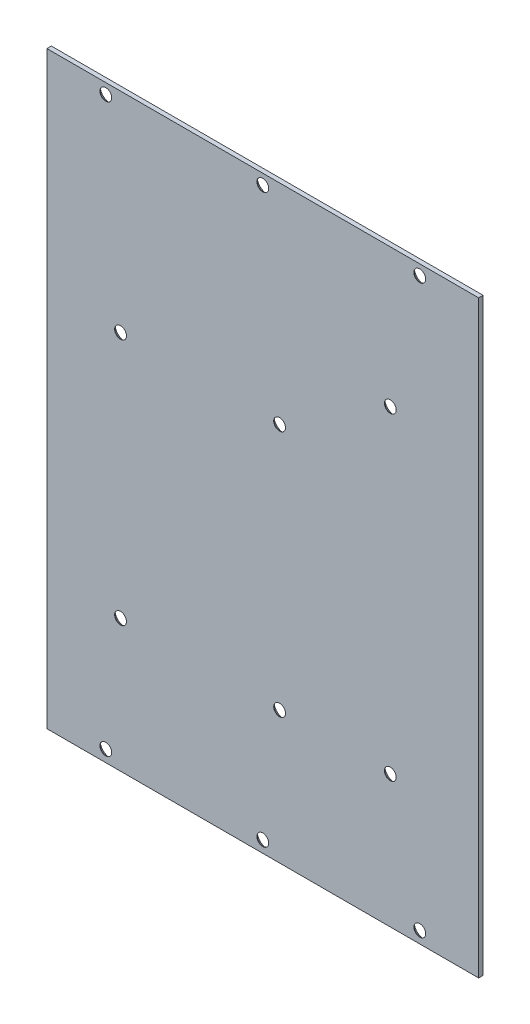
from build123d import *

# Parameters (mm, degrees)
SKETCH_1_W          = 146.6
SKETCH_1_H          = 200
EXTRUDE_1_DEPTH     = 1.5
SKETCH_2_R          = 2
CUT_EXTRUDE_1_DEPTH = 248.979454794
SKETCH_3_R          = 2
CUT_EXTRUDE_2_DEPTH = 248.979454794
SKETCH_4_R          = 2
CUT_EXTRUDE_3_DEPTH = 248.979454794
CHAMFER_1_SIZE      = 1.4


with BuildPart() as part:
    # Эскиз1 → Бобышка-Вытянуть1 (new body)
    with BuildSketch(Plane.XY):
        with Locations((73.3, 100)):
            Rectangle(SKETCH_1_W, SKETCH_1_H)
    extrude(amount=EXTRUDE_1_DEPTH)

    # Эскиз2 → Вырез-Вытянуть1 (cut, through all)
    with BuildSketch(Plane.XY.offset(1.5)):
        with Locations((20, 4)):
            Circle(SKETCH_2_R)
        with Locations((20, 196.5)):
            Circle(SKETCH_2_R)
        with Locations((73.3, 196.5)):
            Circle(SKETCH_2_R)
        with Locations((73.3, 4)):
            Circle(SKETCH_2_R)
        with Locations((126.6, 196.5)):
            Circle(SKETCH_2_R)
        with Locations((126.6, 4)):
            Circle(SKETCH_2_R)
    extrude(amount=-CUT_EXTRUDE_1_DEPTH, mode=Mode.SUBTRACT)

    # Эскиз3 → Вырез-Вытянуть2 (cut, through all)
    with BuildSketch(Plane.XY.offset(1.5)):
        with Locations((25, 45)):
            Circle(SKETCH_3_R)
        with Locations((79, 45)):
            Circle(SKETCH_3_R)
        with Locations((79, 129)):
            Circle(SKETCH_3_R)
        with Locations((25, 129)):
            Circle(SKETCH_3_R)
    extrude(amount=-CUT_EXTRUDE_2_DEPTH, mode=Mode.SUBTRACT)

    # Эскиз4 → Вырез-Вытянуть3 (cut, through all)
    with BuildSketch(Plane.XY.offset(1.5)):
        with Locations((116.6, 45)):
            Circle(SKETCH_4_R)
        with Locations((116.6, 153)):
            Circle(SKETCH_4_R)
    extrude(amount=-CUT_EXTRUDE_3_DEPTH, mode=Mode.SUBTRACT)

    # Фаска1
    chamfer_1_edges = [part.edges().sort_by_distance(p)[0] for p in [
        (124.6, 4, 0),
        (71.3, 196.5, 0),
        (71.3, 4, 0),
        (18, 196.5, 0),
        (124.6, 196.5, 0),
        (18, 4, 0),
        (23, 129, 0),
        (77, 129, 0),
        (77, 45, 0),
        (23, 45, 0),
        (114.6, 45, 0),
        (114.6, 153, 0),
    ]]
    chamfer(chamfer_1_edges, length=CHAMFER_1_SIZE)


solid = part.part
